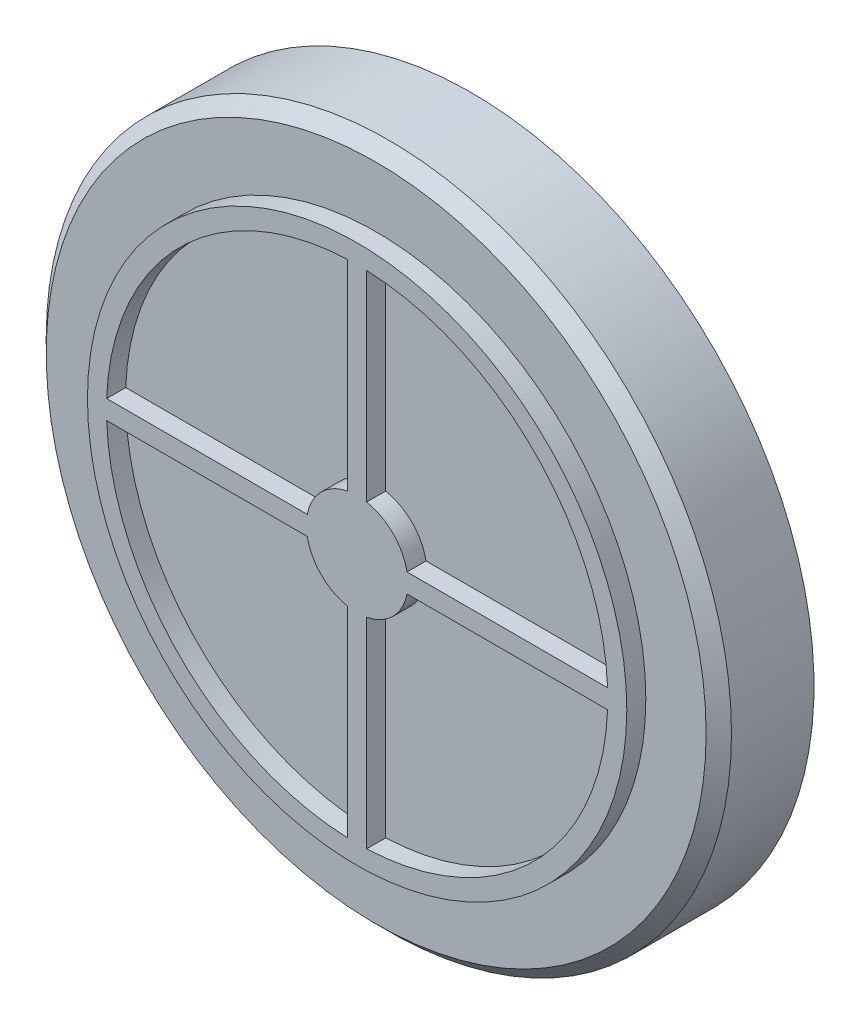
from build123d import *

# Parameters (mm, degrees)
EXTRUDE_1_DEPTH                  = 10
FILLET_1_R                       = 2
PATTERN_CIRCULAR_2_COUNT         = 3
FILLET_1_OF_PATTERN_CIRCULAR_2_R = 2
CUT_EXTRUDE_START                = -15
SKETCH_3_R                       = 51
CUT_EXTRUDE_1_DEPTH              = 15
SKETCH_4_R                       = 62.618720145
SKETCH_4_R_2                     = 57
CUT_EXTRUDE_2_DEPTH              = 15
CHAMFER_1_SIZE                   = 2
FILLET_2_R                       = 5
SKETCH_5_R                       = 42.5
EXTRUDE_2_DEPTH                  = 3
SKETCH_7_R                       = 39.5
CUT_EXTRUDE_3_DEPTH              = 3
EXTRUDE_START                    = 3
SKETCH_8_W                       = 3
SKETCH_8_H                       = 3
EXTRUDE_4_DEPTH                  = 3
SKETCH_9_R                       = 73.179522897
CUT_EXTRUDE_4_DEPTH              = 130


with BuildPart() as part:
    # Эскиз1 → Повернуть1 (revolve)
    with BuildSketch(Plane(origin=(0, 0, 0), x_dir=(1, 0, 0), z_dir=(0, 1, 0))):
        Polygon((0, 0), (-54, 0), (-54, 145), (-51, 145), (-51, 3), (0, 3), align=None)
    revolve(axis=Axis((0, 0, -3), (0, 0, 1)))

    # Эскиз2 → Бобышка-Вытянуть1 (add)
    with BuildSketch(Plane(origin=(57, 0, 0), x_dir=(0, 0, -1), z_dir=(1, 0, 0))):
        Polygon((145, 14), (145, -14), (140, -14), (138.5, 11), (134, 11), (134, 14), align=None)
    extrude_1 = extrude(amount=-EXTRUDE_1_DEPTH)

    # Скругление1
    fillet_1_edges = [part.edges().sort_by_distance(p)[0] for p in [
        (54.576809621, -14, -140),
    ]]
    fillet(fillet_1_edges, radius=FILLET_1_R)

    # Круговой массив2: Бобышка-Вытянуть1 ×3 about axis
    pattern_circular_2_axis = Axis((0, 0, 0), (0, 0, 1))
    for i in range(1, PATTERN_CIRCULAR_2_COUNT):
        add(extrude_1.rotate(pattern_circular_2_axis, i * 360 / PATTERN_CIRCULAR_2_COUNT))

    # Скругление1 of Круговой массив2
    fillet_1_of_pattern_circular_2_edges = [part.edges().sort_by_distance(p)[0] for p in [
        (-15.164049157, 54.264903589, -140),
        (-39.412760463, -40.264903589, -140),
    ]]
    fillet(fillet_1_of_pattern_circular_2_edges, radius=FILLET_1_OF_PATTERN_CIRCULAR_2_R)

    # Эскиз3 → Вырез-Вытянуть1 (cut)
    with BuildSketch(Plane(origin=(0, 0, -145), x_dir=(-1, 0, 0), z_dir=(0, 0, -1)).offset(CUT_EXTRUDE_START)):
        Circle(SKETCH_3_R)
    extrude(amount=CUT_EXTRUDE_1_DEPTH, mode=Mode.SUBTRACT)

    # Эскиз4 → Вырез-Вытянуть2 (cut)
    with BuildSketch(Plane(origin=(0, 0, -145), x_dir=(-1, 0, 0), z_dir=(0, 0, -1))):
        Circle(SKETCH_4_R)
        Circle(SKETCH_4_R_2, mode=Mode.SUBTRACT)
    extrude(amount=-CUT_EXTRUDE_2_DEPTH, mode=Mode.SUBTRACT)

    # Фаска1
    chamfer_1_edges = [part.edges().sort_by_distance(p)[0] for p in [
        (54, 0, 0),
    ]]
    chamfer(chamfer_1_edges, length=CHAMFER_1_SIZE)

    # Скругление2
    fillet_2_edges = [part.edges().sort_by_distance(p)[0] for p in [
        (51, 0, -3),
    ]]
    fillet(fillet_2_edges, radius=FILLET_2_R)

    # Эскиз5 → Бобышка-Вытянуть2 (add)
    with BuildSketch(Plane.XY):
        Circle(SKETCH_5_R)
    extrude(amount=EXTRUDE_2_DEPTH)

    # Эскиз7 → Вырез-Вытянуть3 (cut)
    with BuildSketch(Plane.XY.offset(3)):
        Circle(SKETCH_7_R)
    extrude(amount=-CUT_EXTRUDE_3_DEPTH, mode=Mode.SUBTRACT)

    # Эскиз8 → Бобышка-Вытянуть4 (add)
    with BuildSketch(Plane.XY.offset(EXTRUDE_START)):
        with BuildLine():
            Line((-1.5, -7.858116823), (-1.5, -39.471508712))
            ThreePointArc((-1.5, -39.471508712), (0, -39.5), (1.5, -39.471508712))
            Line((1.5, -39.471508712), (1.5, -7.858116823))
            ThreePointArc((1.5, -7.858116823), (0, -8), (-1.5, -7.858116823))
        make_face()
        with BuildLine():
            ThreePointArc((1.5, 39.471508712), (0, 39.5), (-1.5, 39.471508712))
            Line((-1.5, 39.471508712), (-1.5, 7.858116823))
            ThreePointArc((-1.5, 7.858116823), (0, 8), (1.5, 7.858116823))
            Line((1.5, 7.858116823), (1.5, 39.471508712))
        make_face()
        with BuildLine():
            Line((-1.5, 7.858116823), (-1.5, 1.5))
            Line((-1.5, 1.5), (1.5, 1.5))
            Line((1.5, 1.5), (1.5, 7.858116823))
            ThreePointArc((1.5, 7.858116823), (0, 8), (-1.5, 7.858116823))
        make_face()
        with BuildLine():
            Line((1.5, 7.858116823), (1.5, 1.5))
            Line((1.5, 1.5), (7.858116823, 1.5))
            ThreePointArc((7.858116823, 1.5), (5.656854249, 5.656854249), (1.5, 7.858116823))
        make_face()
        with BuildLine():
            Line((1.5, 1.5), (1.5, -1.5))
            Line((1.5, -1.5), (7.858116823, -1.5))
            ThreePointArc((7.858116823, -1.5), (7.964450219, -0.753347668), (8, 0))
            ThreePointArc((8, 0), (7.964450219, 0.753347668), (7.858116823, 1.5))
            Line((7.858116823, 1.5), (1.5, 1.5))
        make_face()
        with BuildLine():
            ThreePointArc((-39.471508712, 1.5), (-39.5, 0), (-39.471508712, -1.5))
            Line((-39.471508712, -1.5), (-7.858116823, -1.5))
            ThreePointArc((-7.858116823, -1.5), (-8, 0), (-7.858116823, 1.5))
            Line((-7.858116823, 1.5), (-39.471508712, 1.5))
        make_face()
        with BuildLine():
            Line((7.858116823, -1.5), (39.471508712, -1.5))
            ThreePointArc((39.471508712, -1.5), (39.492876536, -0.75013528), (39.5, 0))
            ThreePointArc((39.5, 0), (39.492876536, 0.75013528), (39.471508712, 1.5))
            Line((39.471508712, 1.5), (7.858116823, 1.5))
            ThreePointArc((7.858116823, 1.5), (7.964450219, 0.753347668), (8, 0))
            ThreePointArc((8, 0), (7.964450219, -0.753347668), (7.858116823, -1.5))
        make_face()
        with BuildLine():
            Line((1.5, -1.5), (1.5, -7.858116823))
            ThreePointArc((1.5, -7.858116823), (5.656854249, -5.656854249), (7.858116823, -1.5))
            Line((7.858116823, -1.5), (1.5, -1.5))
        make_face()
        with BuildLine():
            Line((-1.5, -1.5), (-1.5, -7.858116823))
            ThreePointArc((-1.5, -7.858116823), (0, -8), (1.5, -7.858116823))
            Line((1.5, -7.858116823), (1.5, -1.5))
            Line((1.5, -1.5), (-1.5, -1.5))
        make_face()
        Rectangle(SKETCH_8_W, SKETCH_8_H)
        with BuildLine():
            Line((-7.858116823, 1.5), (-1.5, 1.5))
            Line((-1.5, 1.5), (-1.5, 7.858116823))
            ThreePointArc((-1.5, 7.858116823), (-5.656854249, 5.656854249), (-7.858116823, 1.5))
        make_face()
        with BuildLine():
            Line((-7.858116823, -1.5), (-1.5, -1.5))
            Line((-1.5, -1.5), (-1.5, 1.5))
            Line((-1.5, 1.5), (-7.858116823, 1.5))
            ThreePointArc((-7.858116823, 1.5), (-8, 0), (-7.858116823, -1.5))
        make_face()
        with BuildLine():
            ThreePointArc((-7.858116823, -1.5), (-5.656854249, -5.656854249), (-1.5, -7.858116823))
            Line((-1.5, -7.858116823), (-1.5, -1.5))
            Line((-1.5, -1.5), (-7.858116823, -1.5))
        make_face()
    extrude(amount=-EXTRUDE_4_DEPTH)

    # Эскиз9 → Вырез-Вытянуть4 (cut)
    with BuildSketch(Plane(origin=(0, 0, -145), x_dir=(-1, 0, 0), z_dir=(0, 0, -1))):
        Circle(SKETCH_9_R)
    extrude(amount=-CUT_EXTRUDE_4_DEPTH, mode=Mode.SUBTRACT)


solid = part.part
